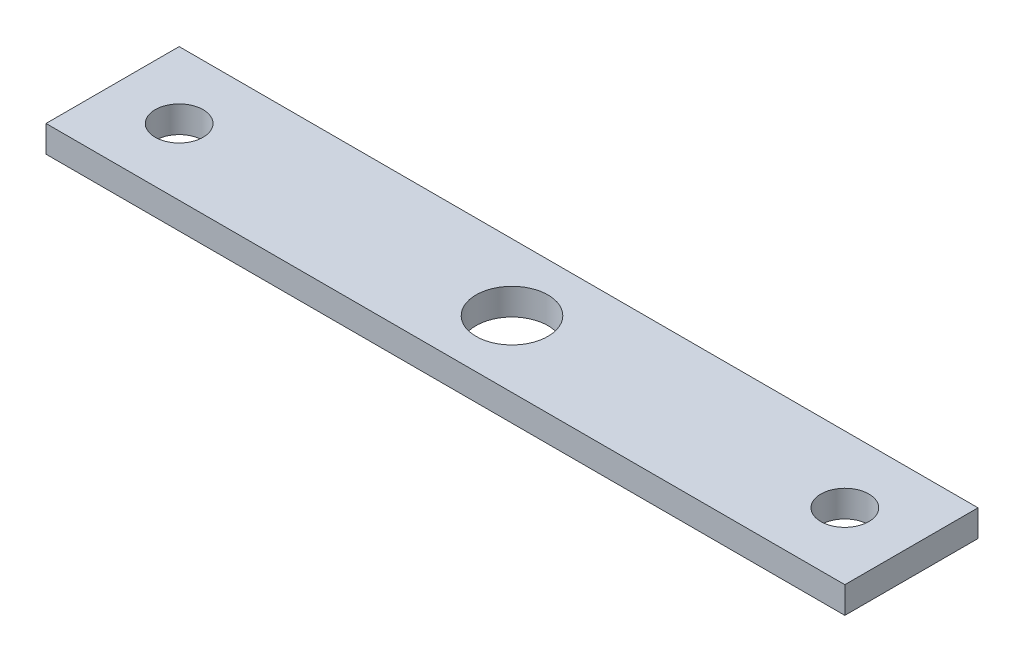
from build123d import *

# Parameters (mm, degrees)
SKETCH1_W           = 76.2
SKETCH1_H           = 12.7
SKETCH1_R           = 3.429
SKETCH1_R_2         = 2.286
BOSS_EXTRUDE1_DEPTH = 2.54


with BuildPart() as part:
    # Sketch1 → Boss-Extrude1 (new body)
    with BuildSketch(Plane(origin=(0, 0, 0), x_dir=(1, 0, 0), z_dir=(0, 1, 0))):
        Rectangle(SKETCH1_W, SKETCH1_H)
        with Locations(Location((0, 0, 0), (0, 0, 270))):
            Circle(SKETCH1_R, mode=Mode.SUBTRACT)
        with Locations(Location((31.75, 0, 0), (0, 0, 270))):
            Circle(SKETCH1_R_2, mode=Mode.SUBTRACT)
        with Locations(Location((-31.75, 0, 0), (0, 0, 270))):
            Circle(SKETCH1_R_2, mode=Mode.SUBTRACT)
    extrude(amount=BOSS_EXTRUDE1_DEPTH)


solid = part.part
